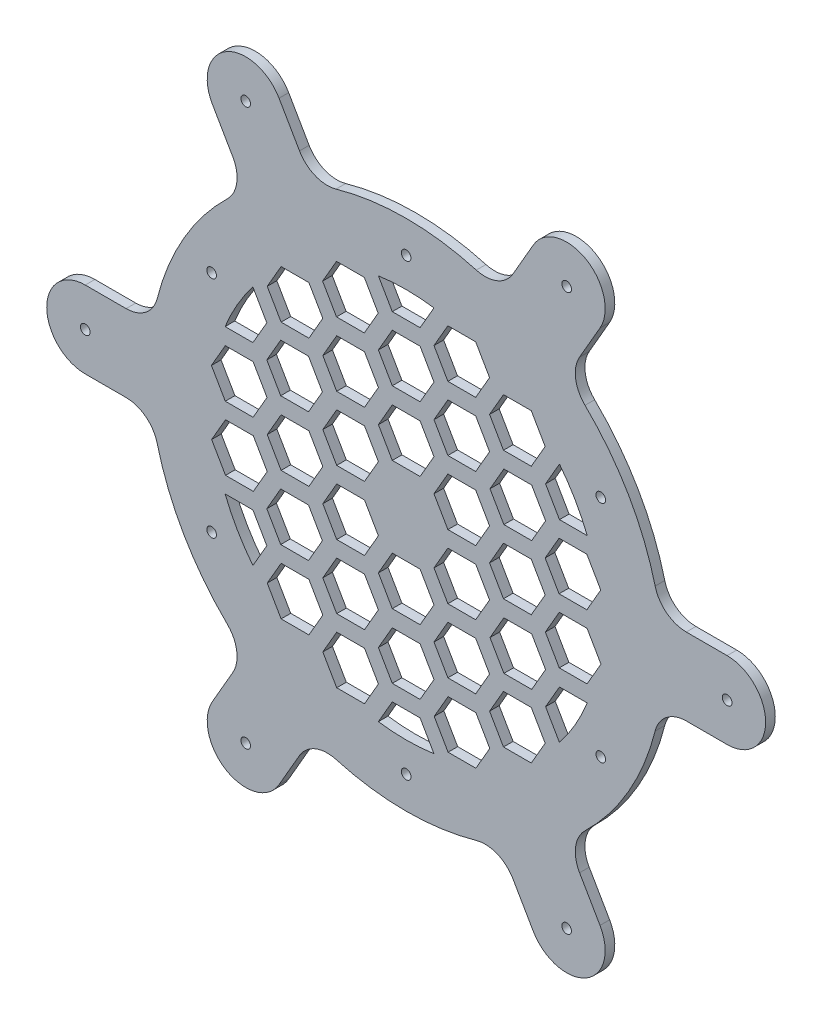
from build123d import *

# Parameters (mm, degrees)
SKETCH1_R           = 1.5
BOSS_EXTRUDE1_DEPTH = 3


with BuildPart() as part:
    # Sketch1 → Boss-Extrude1 (new body)
    with BuildSketch(Plane.XY):
        with BuildLine():
            Line((-54.027153304, 69.577774511), (-60.392304845, 80.602540378))
            ThreePointArc((-60.392304845, 80.602540378), (-56, 96.994845224), (-39.607695155, 92.602540378))
            Line((-39.607695155, 92.602540378), (-33.242543613, 81.577774511))
            ThreePointArc((-33.242543613, 81.577774511), (-28.3404086, 77.310814848), (-21.850924067, 76.958021787))
            ThreePointArc((-21.850924067, 76.958021787), (0, 80), (21.850924067, 76.958021787))
            ThreePointArc((21.850924067, 76.958021787), (28.3404086, 77.310814848), (33.242543613, 81.577774511))
            Line((33.242543613, 81.577774511), (39.607695155, 92.602540378))
            ThreePointArc((39.607695155, 92.602540378), (56, 96.994845224), (60.392304845, 80.602540378))
            Line((60.392304845, 80.602540378), (54.027153304, 69.577774511))
            ThreePointArc((54.027153304, 69.577774511), (52.782925345, 63.198921225), (55.722139859, 57.402466232))
            ThreePointArc((55.722139859, 57.402466232), (69.282032303, 40), (77.573063926, 19.555555556))
            ThreePointArc((77.573063926, 19.555555556), (81.123333946, 14.111893623), (87.269696917, 12))
            Line((87.269696917, 12), (100, 12))
            ThreePointArc((100, 12), (112, 0), (100, -12))
            Line((100, -12), (87.269696917, -12))
            ThreePointArc((87.269696917, -12), (81.123333946, -14.111893623), (77.573063926, -19.555555556))
            ThreePointArc((77.573063926, -19.555555556), (69.282032303, -40), (55.722139859, -57.402466232))
            ThreePointArc((55.722139859, -57.402466232), (52.782925345, -63.198921225), (54.027153304, -69.577774511))
            Line((54.027153304, -69.577774511), (60.392304845, -80.602540378))
            ThreePointArc((60.392304845, -80.602540378), (56, -96.994845224), (39.607695155, -92.602540378))
            Line((39.607695155, -92.602540378), (33.242543613, -81.577774511))
            ThreePointArc((33.242543613, -81.577774511), (28.3404086, -77.310814848), (21.850924067, -76.958021787))
            ThreePointArc((21.850924067, -76.958021787), (0, -80), (-21.850924067, -76.958021787))
            ThreePointArc((-21.850924067, -76.958021787), (-28.3404086, -77.310814848), (-33.242543613, -81.577774511))
            Line((-33.242543613, -81.577774511), (-39.607695155, -92.602540378))
            ThreePointArc((-39.607695155, -92.602540378), (-56, -96.994845224), (-60.392304845, -80.602540378))
            Line((-60.392304845, -80.602540378), (-54.027153304, -69.577774511))
            ThreePointArc((-54.027153304, -69.577774511), (-52.782925345, -63.198921225), (-55.722139859, -57.402466232))
            ThreePointArc((-55.722139859, -57.402466232), (-69.282032303, -40), (-77.573063926, -19.555555556))
            ThreePointArc((-77.573063926, -19.555555556), (-81.123333946, -14.111893623), (-87.269696917, -12))
            Line((-87.269696917, -12), (-100, -12))
            ThreePointArc((-100, -12), (-112, 0), (-100, 12))
            Line((-100, 12), (-87.269696917, 12))
            ThreePointArc((-87.269696917, 12), (-81.123333946, 14.111893623), (-77.573063926, 19.555555556))
            ThreePointArc((-77.573063926, 19.555555556), (-69.282032303, 40), (-55.722139859, 57.402466232))
            ThreePointArc((-55.722139859, 57.402466232), (-52.782925345, 63.198921225), (-54.027153304, 69.577774511))
        make_face()
        with Locations((100, 0)):
            Circle(SKETCH1_R, mode=Mode.SUBTRACT)
        with Locations((50, -86.602540378)):
            Circle(SKETCH1_R, mode=Mode.SUBTRACT)
        with Locations((-50, -86.602540378)):
            Circle(SKETCH1_R, mode=Mode.SUBTRACT)
        with Locations((-100, 0)):
            Circle(SKETCH1_R, mode=Mode.SUBTRACT)
        with Locations((-50, 86.602540378)):
            Circle(SKETCH1_R, mode=Mode.SUBTRACT)
        with Locations((50, 86.602540378)):
            Circle(SKETCH1_R, mode=Mode.SUBTRACT)
        with Locations((0, 70)):
            Circle(SKETCH1_R, mode=Mode.SUBTRACT)
        with Locations((60.621778265, 35)):
            Circle(SKETCH1_R, mode=Mode.SUBTRACT)
        with Locations((60.621778265, -35)):
            Circle(SKETCH1_R, mode=Mode.SUBTRACT)
        with Locations((0, -70)):
            Circle(SKETCH1_R, mode=Mode.SUBTRACT)
        with Locations((-60.621778265, -35)):
            Circle(SKETCH1_R, mode=Mode.SUBTRACT)
        with Locations((-60.621778265, 35)):
            Circle(SKETCH1_R, mode=Mode.SUBTRACT)
        Polygon((-4.330127019, 27.5), (-8.660254038, 20), (-4.330127019, 12.5), (4.330127019, 12.5), (8.660254038, 20), (4.330127019, 27.5), align=None, mode=Mode.SUBTRACT)
        Polygon((-8.660254038, 10), (-12.990381057, 17.5), (-21.650635095, 17.5), (-25.980762114, 10), (-21.650635095, 2.5), (-12.990381057, 2.5), align=None, mode=Mode.SUBTRACT)
        Polygon((21.650635095, 17.5), (12.990381057, 17.5), (8.660254038, 10), (12.990381057, 2.5), (21.650635095, 2.5), (25.980762114, 10), align=None, mode=Mode.SUBTRACT)
        Polygon((25.980762114, -10), (21.650635095, -2.5), (12.990381057, -2.5), (8.660254038, -10), (12.990381057, -17.5), (21.650635095, -17.5), align=None, mode=Mode.SUBTRACT)
        Polygon((4.330127019, -27.5), (8.660254038, -20), (4.330127019, -12.5), (-4.330127019, -12.5), (-8.660254038, -20), (-4.330127019, -27.5), align=None, mode=Mode.SUBTRACT)
        Polygon((-21.650635095, -17.5), (-12.990381057, -17.5), (-8.660254038, -10), (-12.990381057, -2.5), (-21.650635095, -2.5), (-25.980762114, -10), align=None, mode=Mode.SUBTRACT)
        Polygon((8.660254038, 40.149257719), (4.330127019, 47.649257719), (-4.330127019, 47.649257719), (-8.660254038, 40.149257719), (-4.330127019, 32.649257719), (4.330127019, 32.649257719), align=None, mode=Mode.SUBTRACT)
        Polygon((-26.11002309, 20.074628859), (-30.440150108, 27.574628859), (-39.100404146, 27.574628859), (-43.430531165, 20.074628859), (-39.100404146, 12.574628859), (-30.440150108, 12.574628859), align=None, mode=Mode.SUBTRACT)
        Polygon((39.100404146, 12.574628859), (43.430531165, 20.074628859), (39.100404146, 27.574628859), (30.440150108, 27.574628859), (26.11002309, 20.074628859), (30.440150108, 12.574628859), align=None, mode=Mode.SUBTRACT)
        Polygon((30.440150108, -27.574628859), (39.100404146, -27.574628859), (43.430531165, -20.074628859), (39.100404146, -12.574628859), (30.440150108, -12.574628859), (26.11002309, -20.074628859), align=None, mode=Mode.SUBTRACT)
        Polygon((-8.660254038, -40.149257719), (-4.330127019, -47.649257719), (4.330127019, -47.649257719), (8.660254038, -40.149257719), (4.330127019, -32.649257719), (-4.330127019, -32.649257719), align=None, mode=Mode.SUBTRACT)
        Polygon((-39.100404146, -12.574628859), (-43.430531165, -20.074628859), (-39.100404146, -27.574628859), (-30.440150108, -27.574628859), (-26.11002309, -20.074628859), (-30.440150108, -12.574628859), align=None, mode=Mode.SUBTRACT)
        Polygon((-25.980762114, 30), (-21.650635095, 22.5), (-12.990381057, 22.5), (-8.660254038, 30), (-12.990381057, 37.5), (-21.650635095, 37.5), align=None, mode=Mode.SUBTRACT)
        Polygon((-25.980762114, 0), (-30.310889132, 7.5), (-38.97114317, 7.5), (-43.301270189, 0), (-38.97114317, -7.5), (-30.310889132, -7.5), align=None, mode=Mode.SUBTRACT)
        Polygon((12.990381057, 37.5), (8.660254038, 30), (12.990381057, 22.5), (21.650635095, 22.5), (25.980762114, 30), (21.650635095, 37.5), align=None, mode=Mode.SUBTRACT)
        Polygon((38.97114317, 7.5), (30.310889132, 7.5), (25.980762114, 0), (30.310889132, -7.5), (38.97114317, -7.5), (43.301270189, 0), align=None, mode=Mode.SUBTRACT)
        Polygon((25.980762114, -30), (21.650635095, -22.5), (12.990381057, -22.5), (8.660254038, -30), (12.990381057, -37.5), (21.650635095, -37.5), align=None, mode=Mode.SUBTRACT)
        Polygon((-12.990381057, -37.5), (-8.660254038, -30), (-12.990381057, -22.5), (-21.650635095, -22.5), (-25.980762114, -30), (-21.650635095, -37.5), align=None, mode=Mode.SUBTRACT)
        Polygon((-56.35626152, 17.462650559), (-60.686388539, 9.962650559), (-56.35626152, 2.462650559), (-47.696007482, 2.462650559), (-43.365880463, 9.962650559), (-47.696007482, 17.462650559), align=None, mode=Mode.SUBTRACT)
        Polygon((-25.980721686, -40.074628859), (-30.310848704, -32.574628859), (-38.971102742, -32.574628859), (-43.301229761, -40.074628859), (-38.971102742, -47.574628859), (-30.310848704, -47.574628859), align=None, mode=Mode.SUBTRACT)
        Polygon((-13.055031759, 57.537279418), (-21.715285797, 57.537279418), (-26.045412816, 50.037279418), (-21.715285797, 42.537279418), (-13.055031759, 42.537279418), (-8.72490474, 50.037279418), align=None, mode=Mode.SUBTRACT)
        Polygon((43.301229761, 40.074628859), (38.971102742, 47.574628859), (30.310848704, 47.574628859), (25.980721686, 40.074628859), (30.310848704, 32.574628859), (38.971102742, 32.574628859), align=None, mode=Mode.SUBTRACT)
        Polygon((56.35626152, -17.462650559), (60.686388539, -9.962650559), (56.35626152, -2.462650559), (47.696007482, -2.462650559), (43.365880463, -9.962650559), (47.696007482, -17.462650559), align=None, mode=Mode.SUBTRACT)
        Polygon((13.055031759, -57.537279418), (21.715285797, -57.537279418), (26.045412816, -50.037279418), (21.715285797, -42.537279418), (13.055031759, -42.537279418), (8.72490474, -50.037279418), align=None, mode=Mode.SUBTRACT)
        Polygon((-56.291651246, -2.5), (-60.621778265, -10), (-56.291651246, -17.5), (-47.631397208, -17.5), (-43.301270189, -10), (-47.631397208, -2.5), align=None, mode=Mode.SUBTRACT)
        Polygon((-8.660254038, -50), (-12.990381057, -42.5), (-21.650635095, -42.5), (-25.980762114, -50), (-21.650635095, -57.5), (-12.990381057, -57.5), align=None, mode=Mode.SUBTRACT)
        Polygon((-30.310889132, 47.5), (-38.97114317, 47.5), (-43.301270189, 40), (-38.97114317, 32.5), (-30.310889132, 32.5), (-25.980762114, 40), align=None, mode=Mode.SUBTRACT)
        Polygon((25.980762114, 50), (21.650635095, 57.5), (12.990381057, 57.5), (8.660254038, 50), (12.990381057, 42.5), (21.650635095, 42.5), align=None, mode=Mode.SUBTRACT)
        Polygon((56.291651246, 2.5), (60.621778265, 10), (56.291651246, 17.5), (47.631397208, 17.5), (43.301270189, 10), (47.631397208, 2.5), align=None, mode=Mode.SUBTRACT)
        Polygon((30.310889132, -47.5), (38.97114317, -47.5), (43.301270189, -40), (38.97114317, -32.5), (30.310889132, -32.5), (25.980762114, -40), align=None, mode=Mode.SUBTRACT)
        with BuildLine():
            Line((-47.760658184, -22.574628859), (-56.420912222, -22.574628859))
            ThreePointArc((-56.420912222, -22.574628859), (-52.627938427, -30.384754418), (-47.760658184, -37.574628859))
            Line((-47.760658184, -37.574628859), (-43.430531165, -30.074628859))
            Line((-43.430531165, -30.074628859), (-47.760658184, -22.574628859))
        make_face(mode=Mode.SUBTRACT)
        with BuildLine():
            Line((8.660254038, -60.149257719), (4.330127019, -52.649257719))
            Line((4.330127019, -52.649257719), (-4.330127019, -52.649257719))
            Line((-4.330127019, -52.649257719), (-8.660254038, -60.149257719))
            ThreePointArc((-8.660254038, -60.149257719), (0, -60.769508835), (8.660254038, -60.149257719))
        make_face(mode=Mode.SUBTRACT)
        with BuildLine():
            Line((-43.430531165, 30.074628859), (-47.760658184, 37.574628859))
            ThreePointArc((-47.760658184, 37.574628859), (-52.627938427, 30.384754418), (-56.420912222, 22.574628859))
            Line((-56.420912222, 22.574628859), (-47.760658184, 22.574628859))
            Line((-47.760658184, 22.574628859), (-43.430531165, 30.074628859))
        make_face(mode=Mode.SUBTRACT)
        with BuildLine():
            Line((4.330127019, 52.649257719), (8.660254038, 60.149257719))
            ThreePointArc((8.660254038, 60.149257719), (0, 60.769508835), (-8.660254038, 60.149257719))
            Line((-8.660254038, 60.149257719), (-4.330127019, 52.649257719))
            Line((-4.330127019, 52.649257719), (4.330127019, 52.649257719))
        make_face(mode=Mode.SUBTRACT)
        with BuildLine():
            Line((47.760658184, 22.574628859), (56.420912222, 22.574628859))
            ThreePointArc((56.420912222, 22.574628859), (52.627938427, 30.384754418), (47.760658184, 37.574628859))
            Line((47.760658184, 37.574628859), (43.430531165, 30.074628859))
            Line((43.430531165, 30.074628859), (47.760658184, 22.574628859))
        make_face(mode=Mode.SUBTRACT)
        with BuildLine():
            Line((43.430531165, -30.074628859), (47.760658184, -37.574628859))
            ThreePointArc((47.760658184, -37.574628859), (52.627938427, -30.384754418), (56.420912222, -22.574628859))
            Line((56.420912222, -22.574628859), (47.760658184, -22.574628859))
            Line((47.760658184, -22.574628859), (43.430531165, -30.074628859))
        make_face(mode=Mode.SUBTRACT)
    extrude(amount=BOSS_EXTRUDE1_DEPTH)


solid = part.part
